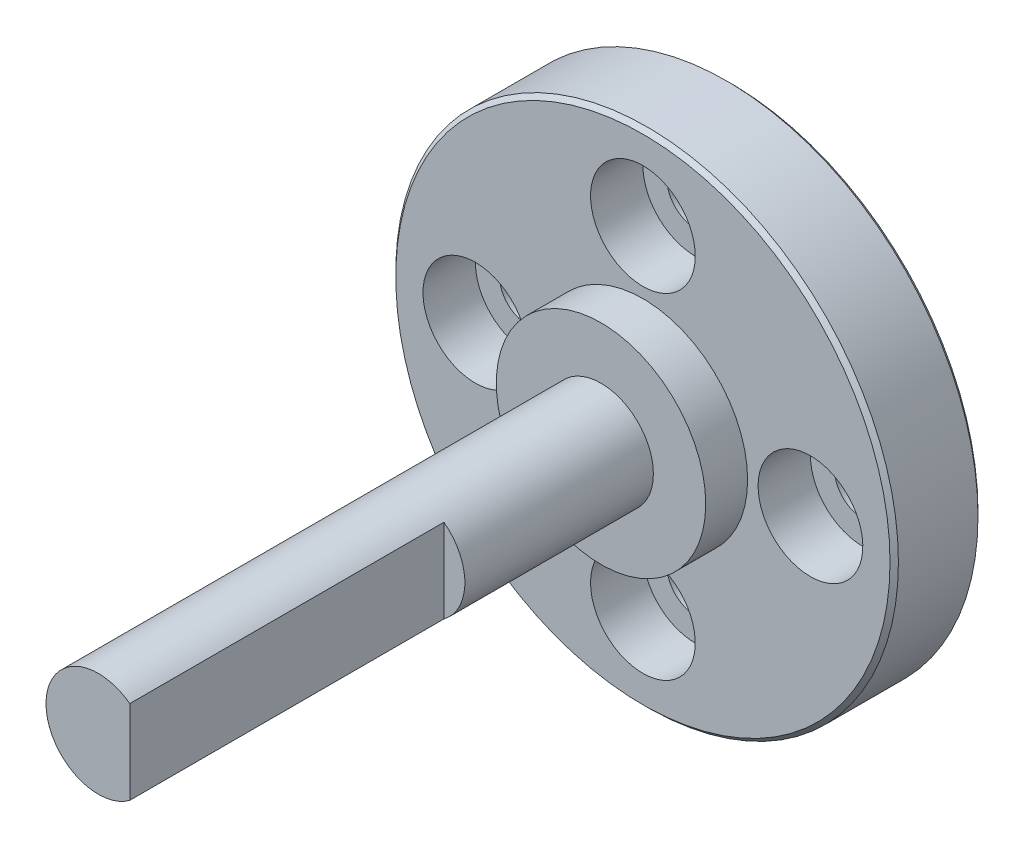
from build123d import *

# Parameters (mm, degrees)
SKETCH_1_R                     = 12
SKETCH_1_R_2                   = 3
EXTRUDE_1_DEPTH                = 4.2
SKETCH_2_R                     = 5
EXTRUDE_2_DEPTH                = 2
HOLE_WIZARD_M2_5_1_D           = 2.7
HOLE_WIZARD_M2_5_1_CBORE_D     = 5
HOLE_WIZARD_M2_5_1_CBORE_DEPTH = 2.5
PATTERN_CIRCULAR_1_COUNT       = 4
CHAMFER_3_SIZE                 = 0.2
SKETCH_12_R                    = 2.5
EXTRUDE_1662_DEPTH             = 26
CUT_EXTRUDE_START              = -15
CUT_EXTRUDE_1_DEPTH            = 15


with BuildPart() as part:
    # 草图1 → 凸台-拉伸1 (new body)
    # profile 1 of 2: a face of its own
    with BuildSketch(Plane.XY):
        Circle(SKETCH_1_R)
        Circle(SKETCH_1_R_2, mode=Mode.SUBTRACT)
    # profile 2 of 2: a face of its own
    with BuildSketch(Plane.XY):
        Circle(SKETCH_1_R_2)
    extrude(amount=EXTRUDE_1_DEPTH)

    # 草图2 → 凸台-拉伸2 (add)
    with BuildSketch(Plane.XY.offset(4.2)):
        Circle(SKETCH_2_R)
    extrude(amount=EXTRUDE_2_DEPTH)

    # M2.5 六角圆柱头螺钉的柱形沉头孔1 (through all)
    with Locations(Plane.XY.offset(4.2)):
        with Locations((0, 8)):
            hole_wizard_m2_5_1 = CounterBoreHole(HOLE_WIZARD_M2_5_1_D / 2, HOLE_WIZARD_M2_5_1_CBORE_D / 2, HOLE_WIZARD_M2_5_1_CBORE_DEPTH)

    # 阵列(圆周)1: M2.5 六角圆柱头螺钉的柱形沉头孔1 ×4 about axis
    pattern_circular_1_axis = Axis((0, 0, 0), (0, 0, 1))
    for i in range(1, PATTERN_CIRCULAR_1_COUNT):
        add(hole_wizard_m2_5_1.rotate(pattern_circular_1_axis, i * 360 / PATTERN_CIRCULAR_1_COUNT), mode=Mode.SUBTRACT)

    # 倒角3
    chamfer_3_edges = [part.edges().sort_by_distance(p)[0] for p in [
        (-12, 0, 0),
        (-12, 0, 4.2),
    ]]
    chamfer(chamfer_3_edges, length=CHAMFER_3_SIZE)

    # 草图12 → Extrude 1662 (add)
    with BuildSketch(Plane.XY.offset(4.2)):
        with Locations(Location((0, 0, 0), (0, 0, 180))):
            Circle(SKETCH_12_R)
    extrude(amount=EXTRUDE_1662_DEPTH)

    # 草图13 → 切除-拉伸1 (cut)
    with BuildSketch(Plane.XY.offset(30.2).offset(CUT_EXTRUDE_START)):
        with BuildLine():
            Line((1.5, 2), (1.5, -2))
            ThreePointArc((1.5, -2), (2.5, 0), (1.5, 2))
        make_face()
    extrude(amount=CUT_EXTRUDE_1_DEPTH, mode=Mode.SUBTRACT)


solid = part.part
